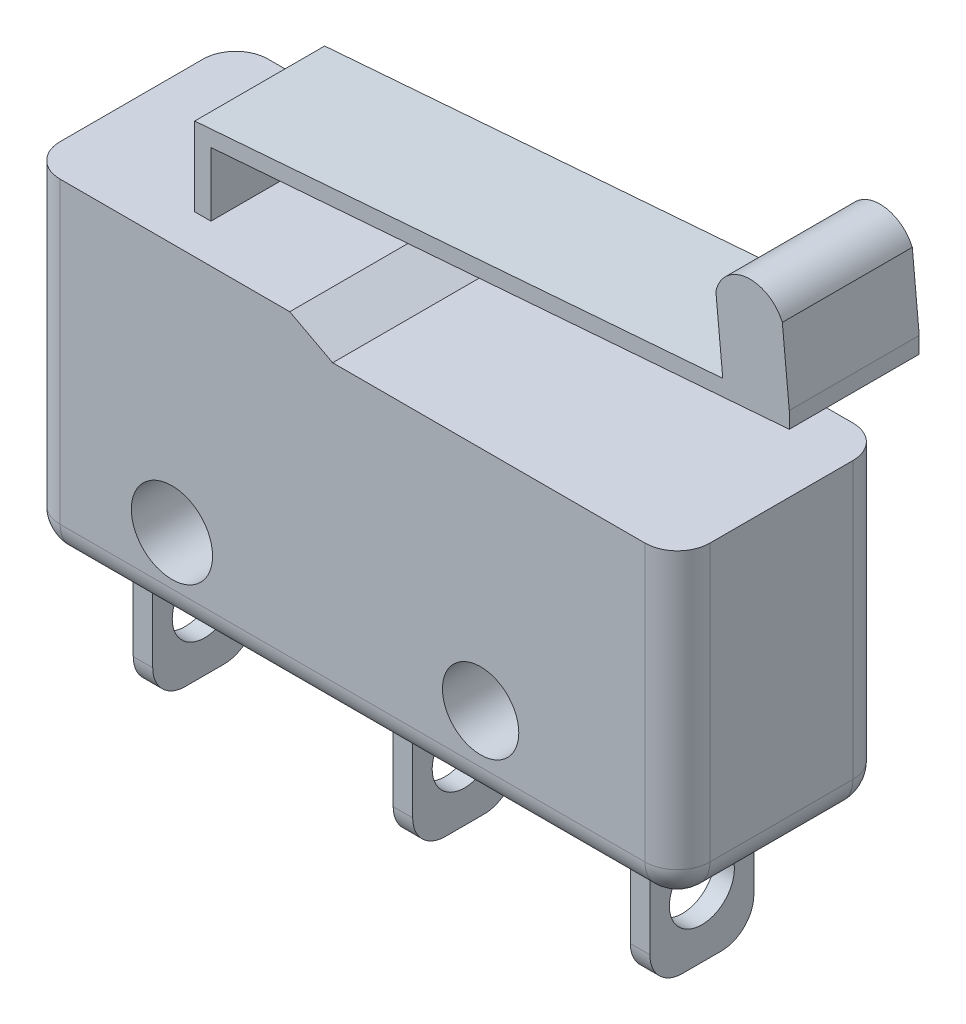
from build123d import *

# Parameters (mm, degrees)
SKETCH_1_R           = 1.25
SKETCH_1_R_2         = 1.175
EXTRUDE_1_DEPTH      = 6.4
SKETCH_3_W           = 0.6
SKETCH_3_H           = 3.2
EXTRUDE_2_DEPTH      = 4
SKETCH_4_R           = 1
CUT_EXTRUDE_1_DEPTH  = 20
FILLET_1_R           = 1
FILLET_2_R           = 1
EXTRUDE_3_DEPTH      = 2
EXTRUDE_3_DEPTH_BACK = 2


with BuildPart() as part:
    # 草图1 → 凸台-拉伸1 (new body)
    with BuildSketch(Plane.XY):
        Polygon((-4.440828402, -2.5), (15.559171598, -2.5), (15.559171598, 7), (4.946745562, 7), (3.625739645, 7.7), (-4.440828402, 7.7), align=None)
        Circle(SKETCH_1_R, mode=Mode.SUBTRACT)
        with Locations((9.5, 0)):
            Circle(SKETCH_1_R_2, mode=Mode.SUBTRACT)
    extrude(amount=EXTRUDE_1_DEPTH)

    # 草图3 → 凸台-拉伸2 (add)
    with BuildSketch(Plane.XZ.offset(2.5)):
        with Locations((12.809171598, 3.2)):
            Rectangle(SKETCH_3_W, SKETCH_3_H)
        with Locations((-2.490828402, 3.2)):
            Rectangle(SKETCH_3_W, SKETCH_3_H)
        with Locations((5.509171598, 3.2)):
            Rectangle(SKETCH_3_W, SKETCH_3_H)
    extrude(amount=EXTRUDE_2_DEPTH)

    # 草图4 → 切除-拉伸1 (cut)
    with BuildSketch(Plane.ZY.offset(2.790828402)):
        with Locations((3.2, -4.5)):
            Circle(SKETCH_4_R)
    extrude(amount=-CUT_EXTRUDE_1_DEPTH, mode=Mode.SUBTRACT)

    # 圆角1
    fillet_1_edges = [part.edges().sort_by_distance(p)[0] for p in [
        (-2.490828402, -6.5, 1.6),
        (-2.490828402, -6.5, 4.8),
        (5.509171598, -6.5, 1.6),
        (5.509171598, -6.5, 4.8),
        (12.809171598, -6.5, 1.6),
        (12.809171598, -6.5, 4.8),
    ]]
    fillet(fillet_1_edges, radius=FILLET_1_R)

    # 圆角2
    fillet_2_edges = [part.edges().sort_by_distance(p)[0] for p in [
        (15.559171598, -2.5, 3.2),
        (-4.440828402, -2.5, 3.2),
        (15.559171598, 2.25, 6.4),
        (-4.440828402, 2.6, 6.4),
        (15.559171598, 2.25, 0),
        (5.559171598, -2.5, 0),
        (-4.440828402, 2.6, 0),
        (5.559171598, -2.5, 6.4),
    ]]
    fillet(fillet_2_edges, radius=FILLET_2_R)

    # 草图5 → 凸台-拉伸3 (add, two sides: drawn at the far end of the back side and taken through both)
    with BuildSketch(Plane.XY.offset(3.2).offset(-EXTRUDE_3_DEPTH_BACK)):
        with BuildLine():
            Line((0, 6.283577636), (0, 9.664597829))
            Line((0, 9.664597829), (17.8, 11.053189231))
            Line((17.8, 11.053189231), (17.8, 11.555466087))
            Line((17.8, 11.555466087), (17.585961229, 13.795738554))
            ThreePointArc((17.585961229, 13.795738554), (16.491955313, 14.447080857), (15.54107575, 13.60036733))
            Line((15.54107575, 13.60036733), (15.75254613, 11.386977345))
            Line((15.75254613, 11.386977345), (-0.5, 10.119103985))
            Line((-0.5, 10.119103985), (-0.5, 6.283577636))
            Line((-0.5, 6.283577636), (0, 6.283577636))
        make_face()
    extrude(amount=EXTRUDE_3_DEPTH + EXTRUDE_3_DEPTH_BACK)


solid = part.part
